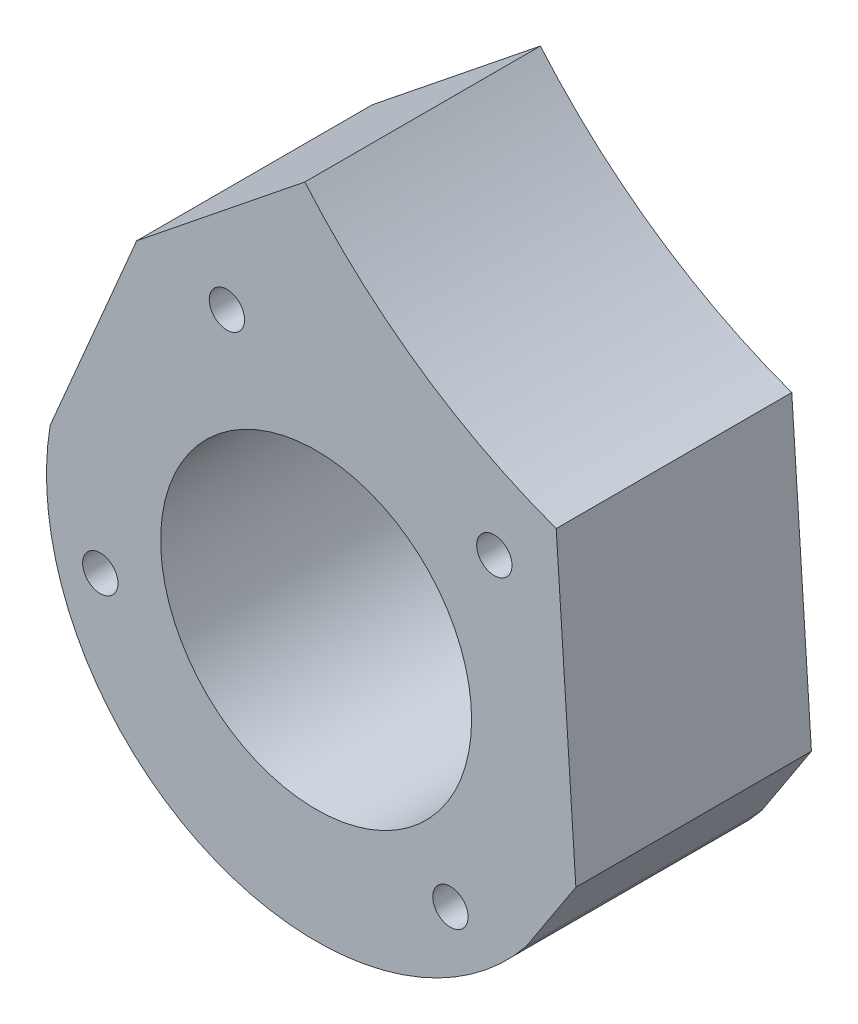
from build123d import *

# Parameters (mm, degrees)
SKETCH_1_R         = 13.2
EXTRUDE_1_DEPTH    = 20
SKETCH1_R          = 1.5
CUT_EXTRUDE1_DEPTH = 64.415064914


with BuildPart() as part:
    # 草图1 → 凸台-拉伸1 (new body)
    with BuildSketch(Plane.XY):
        with BuildLine():
            Line((-26.636659375, 37.991533435), (-33.982028451, 20.754703285))
            ThreePointArc((-33.982028451, 20.754703285), (-20.752268235, -3.895931787), (6.444792613, 2.661525501))
            Line((6.444792613, 2.661525501), (10.6520193, 9.103214753))
            Line((10.6520193, 9.103214753), (8.9820702, 34.644311807))
            ThreePointArc((8.9820702, 34.644311807), (-2.647754906, 40.666580897), (-12.360428284, 49.452053726))
            Line((-12.360428284, 49.452053726), (-12.882509975, 49.032942563))
            Line((-12.882509975, 49.032942563), (-26.636659375, 37.991533435))
        make_face()
        with Locations((-11.400988001, 16.998271389)):
            Circle(SKETCH_1_R, mode=Mode.SUBTRACT)
    extrude(amount=EXTRUDE_1_DEPTH)

    # Sketch1 → Cut-Extrude1 (cut, through all)
    with BuildSketch(Plane(origin=(0, 0, 0), x_dir=(-1, 0, 0), z_dir=(0, 0, -1))):
        with Locations((-3.729872433, 30.054548194)):
            Circle(SKETCH1_R)
        with Locations((-311.403264346, -148.702528504)):
            Circle(SKETCH1_R)
        with Locations((18.975895674, 36.756893457)):
            Circle(SKETCH1_R)
        with Locations((29.72343959, 12.005147937)):
            Circle(SKETCH1_R)
        with Locations((0, 2.339279114)):
            Circle(SKETCH1_R)
    extrude(amount=-CUT_EXTRUDE1_DEPTH, mode=Mode.SUBTRACT)


solid = part.part
